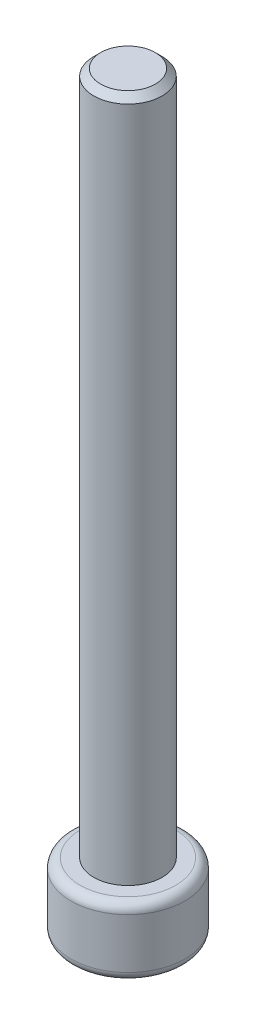
from build123d import *

# Parameters (mm, degrees)
SKETCH1_R           = 2.5
BOSS_EXTRUDE1_DEPTH = 3
SKETCH2_R           = 1.5
BOSS_EXTRUDE2_DEPTH = 30
CHAMFER1_SIZE       = 0.3
FILLET1_R           = 0.4
CUT_EXTRUDE1_DEPTH  = 1.5


with BuildPart() as part:
    # Sketch1 → Boss-Extrude1 (new body)
    with BuildSketch(Plane(origin=(0, 0, 0), x_dir=(1, 0, 0), z_dir=(0, 1, 0))):
        with Locations(Location((0, 0, 0), (0, 0, 270))):
            Circle(SKETCH1_R)
    extrude(amount=BOSS_EXTRUDE1_DEPTH)

    # Sketch2 → Boss-Extrude2 (add)
    with BuildSketch(Plane(origin=(0, 3, 0), x_dir=(1, 0, 0), z_dir=(0, 1, 0))):
        with Locations(Location((0, 0, 0), (0, 0, 270))):
            Circle(SKETCH2_R)
    extrude(amount=BOSS_EXTRUDE2_DEPTH)

    # Chamfer1
    chamfer1_edges = [part.edges().sort_by_distance(p)[0] for p in [
        (0, 33, -1.5),
    ]]
    chamfer(chamfer1_edges, length=CHAMFER1_SIZE)

    # Fillet1
    fillet1_edges = [part.edges().sort_by_distance(p)[0] for p in [
        (0, 0, -2.5),
        (0, 3, -2.5),
    ]]
    fillet(fillet1_edges, radius=FILLET1_R)

    # Sketch3 → Cut-Extrude1 (cut)
    with BuildSketch(Plane.XZ):
        Polygon((1.443375673, 0), (0.721687836, 1.25), (-0.721687836, 1.25), (-1.443375673, 0), (-0.721687836, -1.25), (0.721687836, -1.25), align=None)
    extrude(amount=-CUT_EXTRUDE1_DEPTH, mode=Mode.SUBTRACT)


solid = part.part
